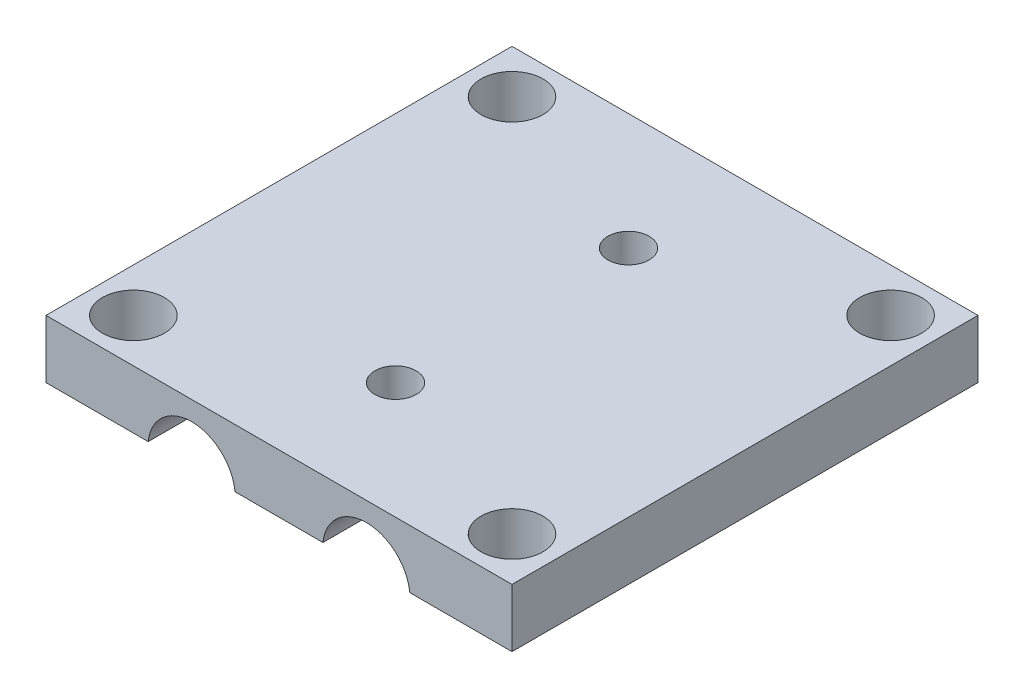
from build123d import *

# Parameters (mm, degrees)
SKETCH1_W               = 50.8
SKETCH1_H               = 50.8
BOSS_EXTRUDE1_DEPTH     = 6.35
SKETCH2_R               = 4.7625
CUT_EXTRUDE1_DEPTH      = 58.15
F_1_4_CLEARANCE_HOLE1_D = 6.7564
F_8_CLEARANCE_HOLE1_D   = 4.4958


with BuildPart() as part:
    # Sketch1 → Boss-Extrude1 (new body)
    with BuildSketch(Plane(origin=(0, 0, 0), x_dir=(1, 0, 0), z_dir=(0, 1, 0))):
        Rectangle(SKETCH1_W, SKETCH1_H)
    extrude(amount=BOSS_EXTRUDE1_DEPTH)

    # Sketch2 → Cut-Extrude1 (cut, through all)
    with BuildSketch(Plane.XY.offset(25.4)):
        with Locations((-9.525, -0.508)):
            Circle(SKETCH2_R)
        with Locations((9.525, -0.508)):
            Circle(SKETCH2_R)
    extrude(amount=-CUT_EXTRUDE1_DEPTH, mode=Mode.SUBTRACT)

    # 1/4 Clearance Hole1 (through all)
    with Locations(Plane(origin=(0, 6.35, 0), x_dir=(1, 0, 0), z_dir=(0, 1, 0))):
        with Locations((-20.6375, -20.6375), (-20.6375, 20.6375), (20.6375, 20.6375), (20.6375, -20.6375)):
            Hole(F_1_4_CLEARANCE_HOLE1_D / 2)

    # #8 Clearance Hole1 (through all)
    with Locations(Plane(origin=(0, 6.35, 0), x_dir=(1, 0, 0), z_dir=(0, 1, 0))):
        with Locations((0, 12.7), (0, -12.7)):
            Hole(F_8_CLEARANCE_HOLE1_D / 2)


solid = part.part
